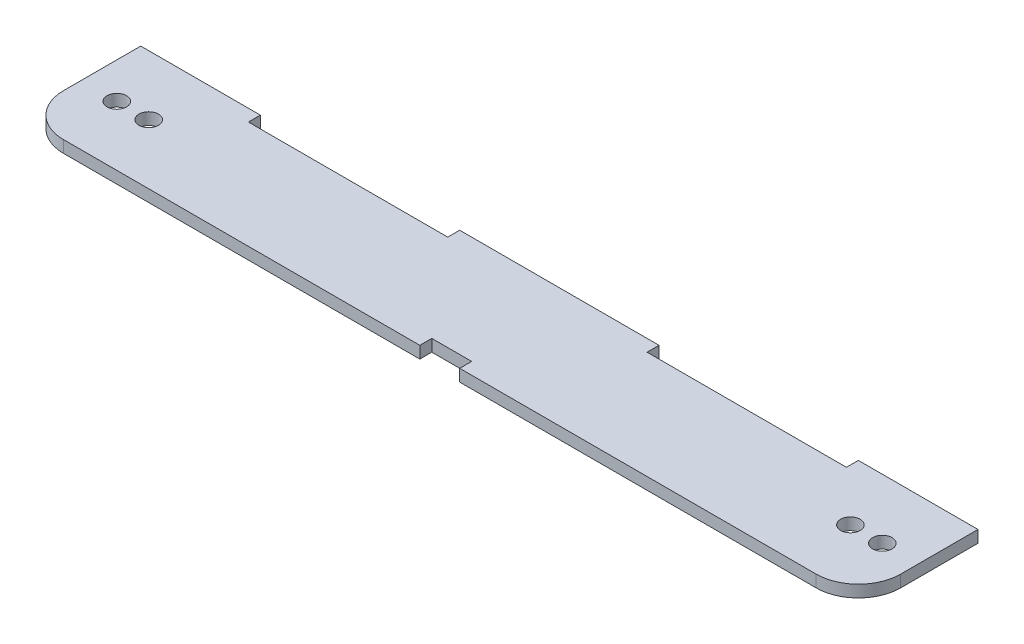
from build123d import *

# Parameters (mm, degrees)
SKETCH1_W               = 210
SKETCH1_H               = 30
BOSS_EXTRUDE1_DEPTH     = 3
CUT_EXTRUDE1_DEPTH      = 107.108435103
CUT_EXTRUDE1_DEPTH_BACK = 107.108435103
SKETCH2_W               = 50
SKETCH2_H               = 3
CUT_EXTRUDE2_DEPTH      = 107.108435103
CUT_EXTRUDE2_DEPTH_BACK = 107.108435103
CUT_EXTRUDE4_DEPTH      = 107.108435103
CUT_EXTRUDE4_DEPTH_BACK = 107.108435103
SKETCH5_R               = 2.45
CUT_EXTRUDE5_DEPTH      = 107.108435103
CUT_EXTRUDE5_DEPTH_BACK = 107.108435103


with BuildPart() as part:
    # Sketch1 → Boss-Extrude1 (new body)
    with BuildSketch(Plane(origin=(0, 0, 0), x_dir=(1, 0, 0), z_dir=(0, 1, 0))):
        Rectangle(SKETCH1_W, SKETCH1_H)
    extrude(amount=BOSS_EXTRUDE1_DEPTH)

    # Sketch2 → Cut-Extrude1 (cut, two sides: drawn at the far end of the back side and taken through both)
    with BuildSketch(Plane(origin=(0, 3, 0), x_dir=(1, 0, 0), z_dir=(0, 1, 0)).offset(-CUT_EXTRUDE1_DEPTH_BACK)):
        with Locations((-50, 13.5)):
            Rectangle(SKETCH2_W, SKETCH2_H)
        with Locations((50, 13.5)):
            Rectangle(SKETCH2_W, SKETCH2_H)
    extrude(amount=CUT_EXTRUDE1_DEPTH + CUT_EXTRUDE1_DEPTH_BACK, mode=Mode.SUBTRACT)

    # Sketch3 → Cut-Extrude2 (cut, two sides: drawn at the far end of the back side and taken through both)
    with BuildSketch(Plane.XZ.offset(-CUT_EXTRUDE2_DEPTH_BACK)):
        Polygon((0, 15), (5, 15), (5, 12), (-5, 12), (-5, 15), align=None)
    extrude(amount=CUT_EXTRUDE2_DEPTH + CUT_EXTRUDE2_DEPTH_BACK, mode=Mode.SUBTRACT)

    # Sketch5 → Cut-Extrude4 (cut, two sides: drawn at the far end of the back side and taken through both)
    with BuildSketch(Plane(origin=(0, 0, 0), x_dir=(1, 0, 0), z_dir=(0, 1, 0)).offset(-CUT_EXTRUDE4_DEPTH_BACK)):
        with Locations(Location((-96, 0, 0), (0, 0, 270))):
            Circle(SKETCH5_R)
        with Locations(Location((-88, 0, 0), (0, 0, 270))):
            Circle(SKETCH5_R)
        with Locations(Location((88, 0, 0), (0, 0, 270))):
            Circle(SKETCH5_R)
        with Locations(Location((96, 0, 0), (0, 0, 270))):
            Circle(SKETCH5_R)
    extrude(amount=CUT_EXTRUDE4_DEPTH + CUT_EXTRUDE4_DEPTH_BACK, mode=Mode.SUBTRACT)

    # Sketch6 → Cut-Extrude5 (cut, two sides: drawn at the far end of the back side and taken through both)
    with BuildSketch(Plane(origin=(0, 0, 0), x_dir=(1, 0, 0), z_dir=(0, 1, 0)).offset(-CUT_EXTRUDE5_DEPTH_BACK)):
        with BuildLine():
            Line((-105, -4.393398282), (-105, -15))
            Line((-105, -15), (-94.393398282, -15))
            ThreePointArc((-94.393398282, -15), (-101.893398282, -11.893398282), (-105, -4.393398282))
        make_face()
        with BuildLine():
            Line((105, -15), (94.393398282, -15))
            ThreePointArc((94.393398282, -15), (101.893398282, -11.893398282), (105, -4.393398282))
            Line((105, -4.393398282), (105, -15))
        make_face()
    extrude(amount=CUT_EXTRUDE5_DEPTH + CUT_EXTRUDE5_DEPTH_BACK, mode=Mode.SUBTRACT)


solid = part.part
